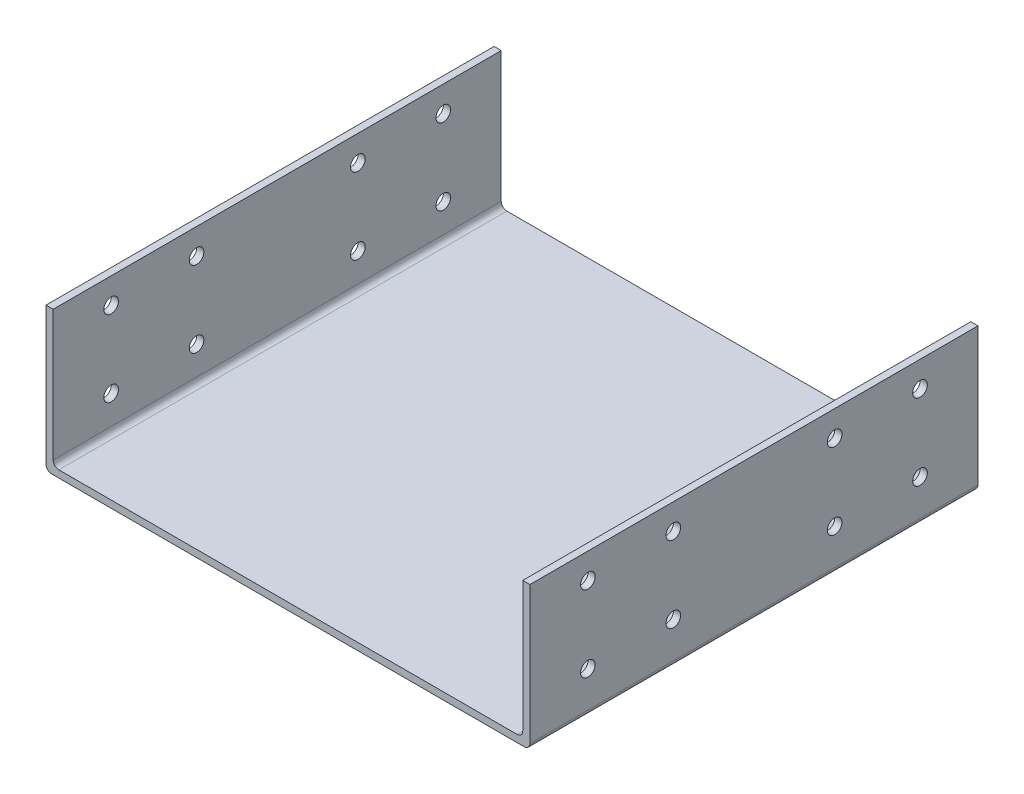
from build123d import *

# Parameters (mm, degrees)
SKETCH2_W           = 171.45
SKETCH2_H           = 158.75
BOSS_EXTRUDE1_DEPTH = 50.8
SKETCH3_W           = 166.37
SKETCH3_H           = 48.26
CUT_EXTRUDE1_DEPTH  = 188.432596218
FILLET1_R           = 2
SKETCH5_R           = 2.5908
SKETCH5_R_2         = 2.5865
CUT_EXTRUDE2_DEPTH  = 196.642871388


with BuildPart() as part:
    # Sketch2 → Boss-Extrude1 (new body)
    with BuildSketch(Plane(origin=(0, 0, 0), x_dir=(1, 0, 0), z_dir=(0, 1, 0))):
        Rectangle(SKETCH2_W, SKETCH2_H)
    extrude(amount=BOSS_EXTRUDE1_DEPTH)

    # Sketch3 → Cut-Extrude1 (cut, through all)
    with BuildSketch(Plane.XY.offset(79.375)):
        with Locations((0, 26.67)):
            Rectangle(SKETCH3_W, SKETCH3_H)
    extrude(amount=-CUT_EXTRUDE1_DEPTH, mode=Mode.SUBTRACT)

    # Fillet1
    fillet1_edges = [part.edges().sort_by_distance(p)[0] for p in [
        (-83.185, 2.54, 0),
        (83.185, 2.54, 0),
        (85.725, 0, 0),
        (-85.725, 0, 0),
    ]]
    fillet(fillet1_edges, radius=FILLET1_R)

    # Sketch5 → Cut-Extrude2 (cut, through all)
    with BuildSketch(Plane(origin=(85.725, 0, 0), x_dir=(0, 0, -1), z_dir=(1, 0, 0))):
        with Locations((-58.83275, 41.7129)):
            Circle(SKETCH5_R)
        with Locations((-58.83275, 14.7)):
            Circle(SKETCH5_R)
        with Locations((58.83275, 41.7129)):
            Circle(SKETCH5_R)
        with Locations((58.83275, 14.7)):
            Circle(SKETCH5_R)
        with Locations((-28.58135, 41.7129)):
            Circle(SKETCH5_R_2)
        with Locations((-28.58135, 14.7)):
            Circle(SKETCH5_R_2)
        with Locations((28.58135, 41.7129)):
            Circle(SKETCH5_R)
        with Locations((28.58135, 14.7)):
            Circle(SKETCH5_R_2)
    extrude(amount=-CUT_EXTRUDE2_DEPTH, mode=Mode.SUBTRACT)


solid = part.part
